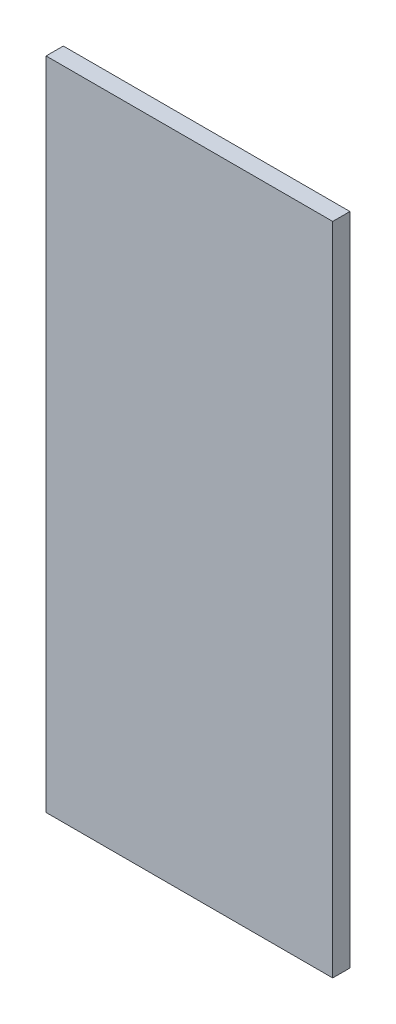
from build123d import *

# Parameters (mm, degrees)
SKETCH1_W           = 50
SKETCH1_H           = 114.3
BOSS_EXTRUDE1_DEPTH = 3


with BuildPart() as part:
    # Sketch1 → Boss-Extrude1 (new body)
    with BuildSketch(Plane.XY):
        Rectangle(SKETCH1_W, SKETCH1_H)
    extrude(amount=BOSS_EXTRUDE1_DEPTH)


solid = part.part
